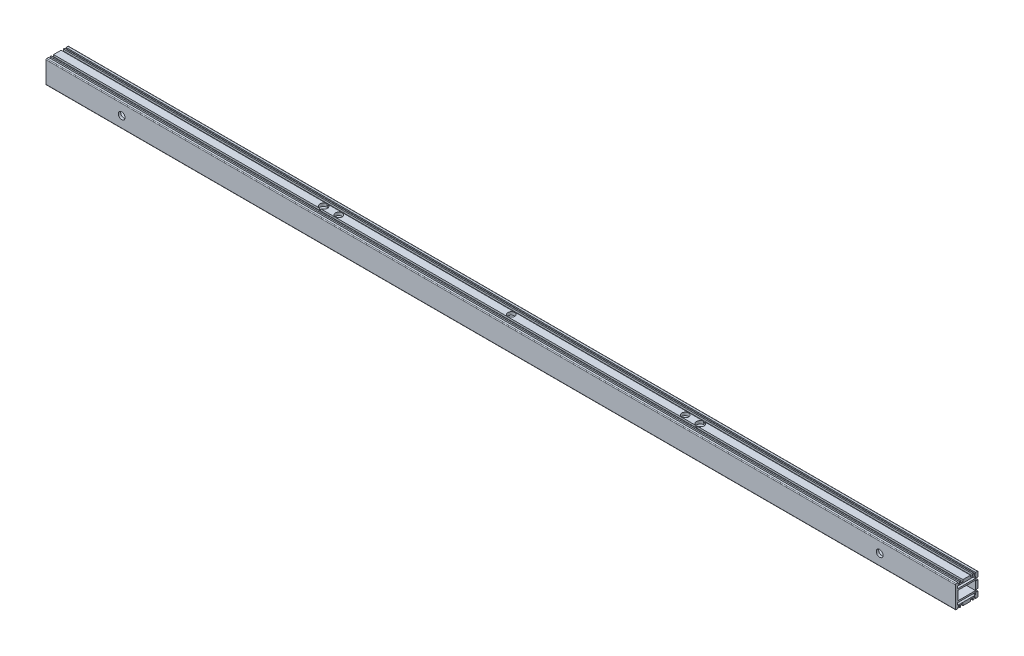
from build123d import *

# Parameters (mm, degrees)
SKETCH_1_W             = 23.5
SKETCH_1_H             = 12
EXTRUDE_1_DEPTH        = 601
HOLE_WIZARD_M6_1_D     = 5
HOLE_WIZARD_M6_1_DEPTH = 15
HOLE_WIZARD_M6_1_TIP   = 1.502151548
HOLE_WIZARD_M6_2_D     = 5
HOLE_WIZARD_M6_2_DEPTH = 15
HOLE_WIZARD_M6_2_TIP   = 1.502151548
SKETCH_9_R             = 4.5
CUT_EXTRUDE_1_DEPTH    = 602.935212461
SKETCH_12_R            = 5.05
CUT_EXTRUDE_6_DEPTH    = 602.935212461
HOLE_WIZARD_M6_3_D     = 5
HOLE_WIZARD_M6_3_DEPTH = 15
HOLE_WIZARD_M6_3_TIP   = 1.502151548
SKETCH_15_R            = 4.5
CUT_EXTRUDE_7_DEPTH    = 15
HOLE_WIZARD_M6_4_D     = 5
HOLE_WIZARD_M6_4_DEPTH = 15
HOLE_WIZARD_M6_4_TIP   = 1.502151548
HOLE_WIZARD_M6_5_D     = 5
HOLE_WIZARD_M6_5_DEPTH = 15
HOLE_WIZARD_M6_5_TIP   = 1.502151548


with BuildPart() as part:
    # 草图1 → 凸台-拉伸1 (new, symmetric)
    with BuildSketch(Plane(origin=(0, 0, 0), x_dir=(0, 0, -1), z_dir=(1, 0, 0))):
        with BuildLine():
            Line((-14, 15), (-11.5, 15))
            Line((-11.5, 15), (-11.5, 13.5))
            Line((-11.5, 13.5), (-11.4, 13.5))
            ThreePointArc((-11.4, 13.5), (-11.117157288, 13.382842712), (-11, 13.1))
            Line((-11, 13.1), (-11, 12))
            Line((-11, 12), (-9.5, 12))
            Line((-9.5, 12), (-9.5, 15))
            Line((-9.5, 15), (-8, 15))
            Line((-8, 15), (-8, 12.5))
            Line((-8, 12.5), (-5, 12.5))
            Line((-5, 12.5), (-5, 15))
            Line((-5, 15), (5, 15))
            Line((5, 15), (5, 12.5))
            Line((5, 12.5), (8, 12.5))
            Line((8, 12.5), (8, 15))
            Line((8, 15), (9.5, 15))
            Line((9.5, 15), (9.5, 12))
            Line((9.5, 12), (11, 12))
            Line((11, 12), (11, 13.1))
            ThreePointArc((11, 13.1), (11.117157288, 13.382842712), (11.4, 13.5))
            Line((11.4, 13.5), (11.5, 13.5))
            Line((11.5, 13.5), (11.5, 15))
            Line((11.5, 15), (14, 15))
            ThreePointArc((14, 15), (14.707106781, 14.707106781), (15, 14))
            Line((15, 14), (15, 8))
            Line((15, 8), (12.5, 8))
            Line((12.5, 8), (12.5, 5))
            Line((12.5, 5), (15, 5))
            Line((15, 5), (15, -5))
            Line((15, -5), (12.5, -5))
            Line((12.5, -5), (12.5, -8))
            Line((12.5, -8), (15, -8))
            Line((15, -8), (15, -14))
            ThreePointArc((15, -14), (14.707106781, -14.707106781), (14, -15))
            Line((14, -15), (11.5, -15))
            Line((11.5, -15), (11.5, -13.5))
            Line((11.5, -13.5), (11.4, -13.5))
            ThreePointArc((11.4, -13.5), (11.117157288, -13.382842712), (11, -13.1))
            Line((11, -13.1), (11, -12))
            Line((11, -12), (9.5, -12))
            Line((9.5, -12), (9.5, -15))
            Line((9.5, -15), (8, -15))
            Line((8, -15), (8, -12.5))
            Line((8, -12.5), (5, -12.5))
            Line((5, -12.5), (5, -15))
            Line((5, -15), (-5, -15))
            Line((-5, -15), (-5, -12.5))
            Line((-5, -12.5), (-8, -12.5))
            Line((-8, -12.5), (-8, -15))
            Line((-8, -15), (-9.5, -15))
            Line((-9.5, -15), (-9.5, -12))
            Line((-9.5, -12), (-11, -12))
            Line((-11, -12), (-11, -13.1))
            ThreePointArc((-11, -13.1), (-11.117157288, -13.382842712), (-11.4, -13.5))
            Line((-11.4, -13.5), (-11.5, -13.5))
            Line((-11.5, -13.5), (-11.5, -15))
            Line((-11.5, -15), (-14, -15))
            ThreePointArc((-14, -15), (-14.707106781, -14.707106781), (-15, -14))
            Line((-15, -14), (-15, 14))
            ThreePointArc((-15, 14), (-14.707106781, 14.707106781), (-14, 15))
        make_face()
        with BuildLine():
            Line((12, -10.5), (12, -8.5))
            ThreePointArc((12, -8.5), (11.853553391, -8.146446609), (11.5, -8))
            Line((11.5, -8), (-11.5, -8))
            ThreePointArc((-11.5, -8), (-11.853553391, -8.146446609), (-12, -8.5))
            Line((-12, -8.5), (-12, -10.5))
            ThreePointArc((-12, -10.5), (-11.853553391, -10.853553391), (-11.5, -11))
            Line((-11.5, -11), (11.5, -11))
            ThreePointArc((11.5, -11), (11.853553391, -10.853553391), (12, -10.5))
        make_face(mode=Mode.SUBTRACT)
        with BuildLine():
            Line((-11.5, 11), (11.5, 11))
            ThreePointArc((11.5, 11), (11.853553391, 10.853553391), (12, 10.5))
            Line((12, 10.5), (12, 8.5))
            ThreePointArc((12, 8.5), (11.853553391, 8.146446609), (11.5, 8))
            Line((11.5, 8), (-11.5, 8))
            ThreePointArc((-11.5, 8), (-11.853553391, 8.146446609), (-12, 8.5))
            Line((-12, 8.5), (-12, 10.5))
            ThreePointArc((-12, 10.5), (-11.853553391, 10.853553391), (-11.5, 11))
        make_face(mode=Mode.SUBTRACT)
        Rectangle(SKETCH_1_W, SKETCH_1_H, mode=Mode.SUBTRACT)
    extrude(amount=EXTRUDE_1_DEPTH, both=True)

    # M6 螺纹孔1
    with Locations(Plane(origin=(0, 0, -15), x_dir=(-1, 0, 0), z_dir=(0, 0, -1))):
        with Locations((-551, 0), (-536, 0), (551, 0), (536, 0)):
            Hole(HOLE_WIZARD_M6_1_D / 2, depth=HOLE_WIZARD_M6_1_DEPTH)
            with Locations((0, 0, -(HOLE_WIZARD_M6_1_DEPTH + HOLE_WIZARD_M6_1_TIP / 2))):  # 118° drill point
                Cone(0, HOLE_WIZARD_M6_1_D / 2, HOLE_WIZARD_M6_1_TIP, mode=Mode.SUBTRACT)

    # M6 螺纹孔2
    with Locations(Plane.XZ.offset(15)):
        with Locations((-551, 0), (-536, 0), (536, 0), (551, 0)):
            Hole(HOLE_WIZARD_M6_2_D / 2, depth=HOLE_WIZARD_M6_2_DEPTH)
            with Locations((0, 0, -(HOLE_WIZARD_M6_2_DEPTH + HOLE_WIZARD_M6_2_TIP / 2))):  # 118° drill point
                Cone(0, HOLE_WIZARD_M6_2_D / 2, HOLE_WIZARD_M6_2_TIP, mode=Mode.SUBTRACT)

    # 草图9 → 切除-拉伸1 (cut, through all)
    with BuildSketch(Plane.XY.offset(15)):
        with Locations((501, 0)):
            Circle(SKETCH_9_R)
        with Locations((-501, 0)):
            Circle(SKETCH_9_R)
    extrude(amount=-CUT_EXTRUDE_1_DEPTH, mode=Mode.SUBTRACT)

    # 草图12 → 切除-拉伸6 (cut, through all)
    with BuildSketch(Plane.XZ.offset(15)):
        with Locations(Location((-249, 0, 0), (0, 0, 90))):
            Circle(SKETCH_12_R)
        with Locations(Location((249, 0, 0), (0, 0, 90))):
            Circle(SKETCH_12_R)
    extrude(amount=-CUT_EXTRUDE_6_DEPTH, mode=Mode.SUBTRACT)

    # M6 螺纹孔3
    with Locations(Plane.XZ.offset(15)):
        with Locations((-229, 0), (-1, 0), (229, 0)):
            Hole(HOLE_WIZARD_M6_3_D / 2, depth=HOLE_WIZARD_M6_3_DEPTH)
            with Locations((0, 0, -(HOLE_WIZARD_M6_3_DEPTH + HOLE_WIZARD_M6_3_TIP / 2))):  # 118° drill point
                Cone(0, HOLE_WIZARD_M6_3_D / 2, HOLE_WIZARD_M6_3_TIP, mode=Mode.SUBTRACT)

    # 草图15 → 切除-拉伸7 (cut)
    with BuildSketch(Plane(origin=(0, 15, 0), x_dir=(-1, 0, 0), z_dir=(0, 1, 0))):
        with Locations(Location((229, 0, 0), (0, 0, 90))):
            Circle(SKETCH_15_R)
        with Locations(Location((1, 0, 0), (0, 0, 90))):
            Circle(SKETCH_15_R)
        with Locations(Location((-229, 0, 0), (0, 0, 90))):
            Circle(SKETCH_15_R)
    extrude(amount=-CUT_EXTRUDE_7_DEPTH, mode=Mode.SUBTRACT)

    # M6 螺纹孔4
    with Locations(Plane(origin=(0, 0, -15), x_dir=(-1, 0, 0), z_dir=(0, 0, -1))):
        with Locations((341, 0), (281, 0), (-281, 0), (-341, 0)):
            Hole(HOLE_WIZARD_M6_4_D / 2, depth=HOLE_WIZARD_M6_4_DEPTH)
            with Locations((0, 0, -(HOLE_WIZARD_M6_4_DEPTH + HOLE_WIZARD_M6_4_TIP / 2))):  # 118° drill point
                Cone(0, HOLE_WIZARD_M6_4_D / 2, HOLE_WIZARD_M6_4_TIP, mode=Mode.SUBTRACT)

    # M6 螺纹孔5
    with Locations(Plane(origin=(0, 0, -15), x_dir=(-1, 0, 0), z_dir=(0, 0, -1))):
        with Locations((446, 0), (376, 0)):
            Hole(HOLE_WIZARD_M6_5_D / 2, depth=HOLE_WIZARD_M6_5_DEPTH)
            with Locations((0, 0, -(HOLE_WIZARD_M6_5_DEPTH + HOLE_WIZARD_M6_5_TIP / 2))):  # 118° drill point
                Cone(0, HOLE_WIZARD_M6_5_D / 2, HOLE_WIZARD_M6_5_TIP, mode=Mode.SUBTRACT)


solid = part.part
